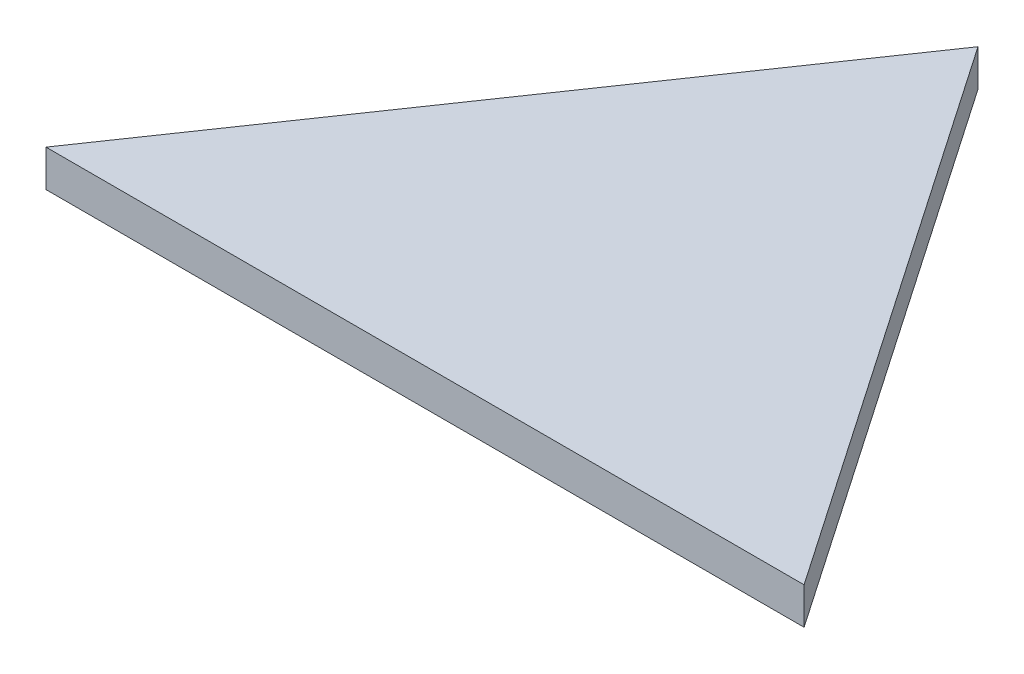
from build123d import *

# Parameters (mm, degrees)
BOSS_EXTRUDE1_DEPTH = 90


with BuildPart() as part:
    # Sketch1 → Boss-Extrude1 (new body)
    with BuildSketch(Plane(origin=(0, 0, 0), x_dir=(1, 0, 0), z_dir=(0, 1, 0))):
        Polygon((0, 0), (1854.056251197, 0), (927.028125598, 1352.370886388), align=None)
    extrude(amount=BOSS_EXTRUDE1_DEPTH)


solid = part.part
